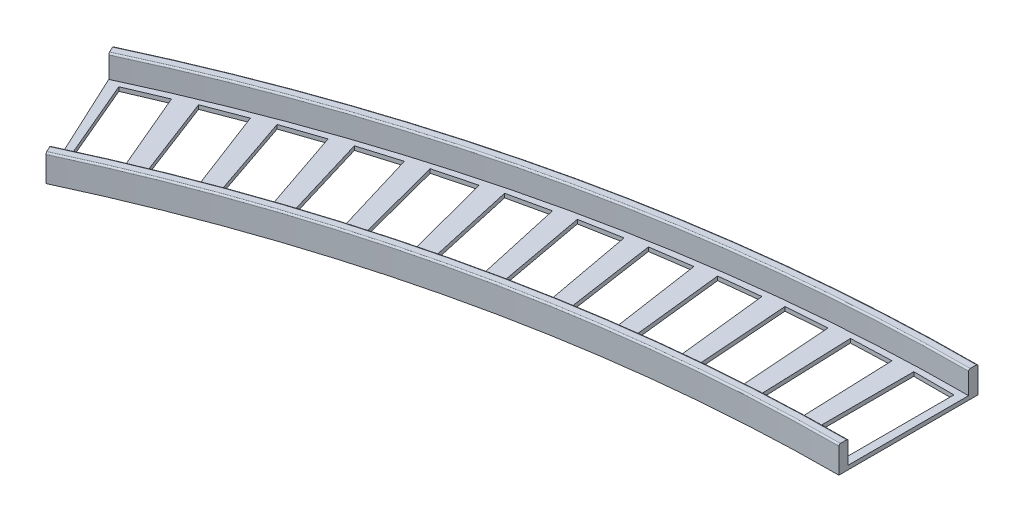
from build123d import *

# Parameters (mm, degrees)
REVOLVE1_ANGLE     = 25
SKETCH4_W          = 15
SKETCH4_H          = 40
CUT_EXTRUDE3_DEPTH = 10


with BuildPart() as part:
    # Sketch1 → Revolve1 (revolve)
    with BuildSketch(Plane(origin=(0, 0, 0), x_dir=(0, 0, -1), z_dir=(1, 0, 0))):
        with BuildLine():
            ThreePointArc((22.5, 9.4), (22.675735931, 9.824264069), (23.1, 10))
            Line((23.1, 10), (25.4, 10))
            ThreePointArc((25.4, 10), (25.824264069, 9.824264069), (26, 9.4))
            Line((26, 9.4), (26, 0))
            Line((26, 0), (-26, 0))
            Line((-26, 0), (-26, 9.4))
            ThreePointArc((-26, 9.4), (-25.824264069, 9.824264069), (-25.4, 10))
            Line((-25.4, 10), (-23.1, 10))
            ThreePointArc((-23.1, 10), (-22.675735931, 9.824264069), (-22.5, 9.4))
            Line((-22.5, 9.4), (-22.5, 1.5))
            Line((-22.5, 1.5), (22.5, 1.5))
            Line((22.5, 1.5), (22.5, 9.4))
        make_face()
    revolve(axis=Axis((0, -3.326119583, 600), (0, 1, 0)), revolution_arc=REVOLVE1_ANGLE)

    # Sketch4 → Cut-Extrude3 (cut)
    with BuildSketch(Plane(origin=(0, 0, 0), x_dir=(1, 0, 0), z_dir=(0, 1, 0))):
        with Locations((-10.5, 0)):
            Rectangle(SKETCH4_W, SKETCH4_H)
        Polygon((-40.608807593, 18.930468426), (-39.149401653, -21.042899387), (-24.159388723, -20.495622159), (-25.618794663, 19.477745654), align=None)
        Polygon((-63.163540118, 17.036763248), (-60.246671595, -22.856743467), (-45.286606577, -21.762917771), (-48.2034751, 18.130588944), align=None)
        Polygon((-85.634163481, 14.321406142), (-81.263716507, -25.439116908), (-66.353520363, -23.800199292), (-70.723967338, 15.960323758), align=None)
        Polygon((-107.990755592, 10.788012904), (-102.172549893, -28.786580998), (-87.33207718, -26.60475386), (-93.150282879, 12.969840041), align=None)
        Polygon((-130.203546201, 6.441288631), (-122.945329355, -32.894678221), (-108.194341785, -30.172846904), (-115.452558632, 9.163119949), align=None)
        Polygon((-152.24295655, 1.287021464), (-143.554393666, -37.757938198), (-128.912533793, -34.499727117), (-137.601096677, 4.545232545), align=None)
        Polygon((-174.079638754, -4.667925128), (-163.972299604, -43.369884966), (-149.459064664, -39.579632785), (-159.566403814, -0.877672947), align=None)
        Polygon((-195.684514881, -11.415621482), (-184.171858492, -49.723045604), (-169.806574446, -45.405799458), (-181.319230835, -7.098375336), align=None)
        Polygon((-217.028815677, -18.947082302), (-204.126172411, -56.808960184), (-189.927968205, -51.970468959), (-202.830611472, -14.108591077), align=None)
        Polygon((-238.084118872, -27.252278624), (-223.808670008, -64.618193035), (-209.796452104, -59.264899711), (-224.071900968, -21.8989853), align=None)
        Polygon((-258.822387025, -36.320151172), (-243.193141886, -73.14034531), (-229.385569084, -67.279378383), (-245.014814224, -30.459184245), align=None)
    extrude(amount=CUT_EXTRUDE3_DEPTH, mode=Mode.SUBTRACT)


solid = part.part
